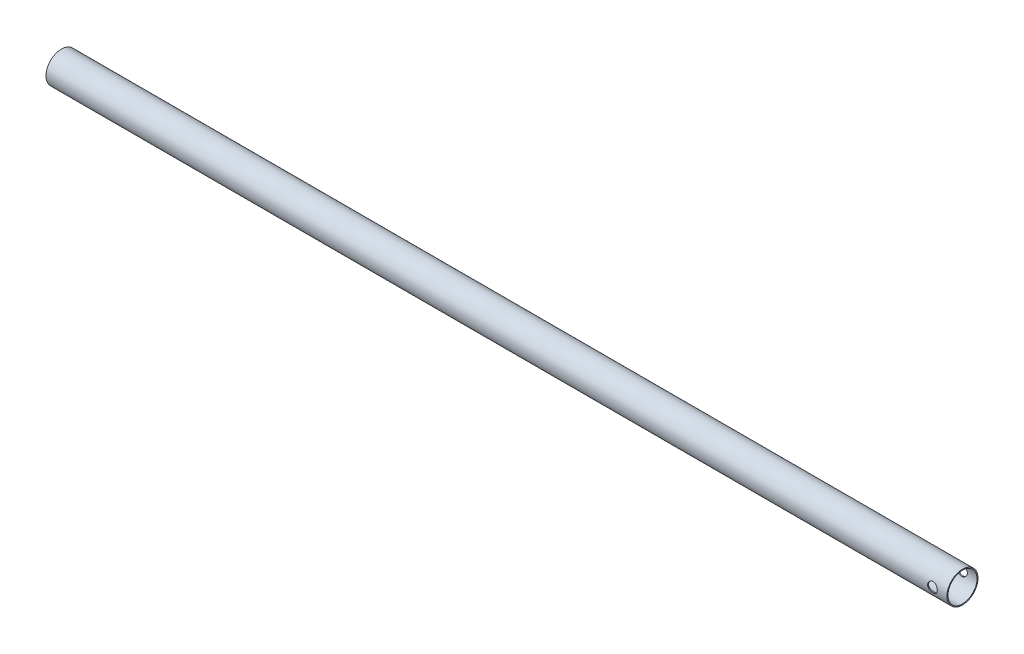
from build123d import *

# Parameters (mm, degrees)
SKETCH2_R           = 16
SKETCH2_R_2         = 15
EXTRUDE_THIN1_DEPTH = 929
SKETCH4_R           = 5
CUT_EXTRUDE1_DEPTH  = 20


with BuildPart() as part:
    # Sketch2 → Extrude-Thin1 (new body)
    with BuildSketch(Plane(origin=(0, 0, 0), x_dir=(0, 0, -1), z_dir=(1, 0, 0))):
        Circle(SKETCH2_R)
        Circle(SKETCH2_R_2, mode=Mode.SUBTRACT)
    extrude(amount=-EXTRUDE_THIN1_DEPTH)

    # Sketch4 → Cut-Extrude1 (cut, symmetric)
    with BuildSketch(Plane.XY):
        with Locations((-15, 0)):
            Circle(SKETCH4_R)
    extrude(amount=CUT_EXTRUDE1_DEPTH, both=True, mode=Mode.SUBTRACT)


solid = part.part
